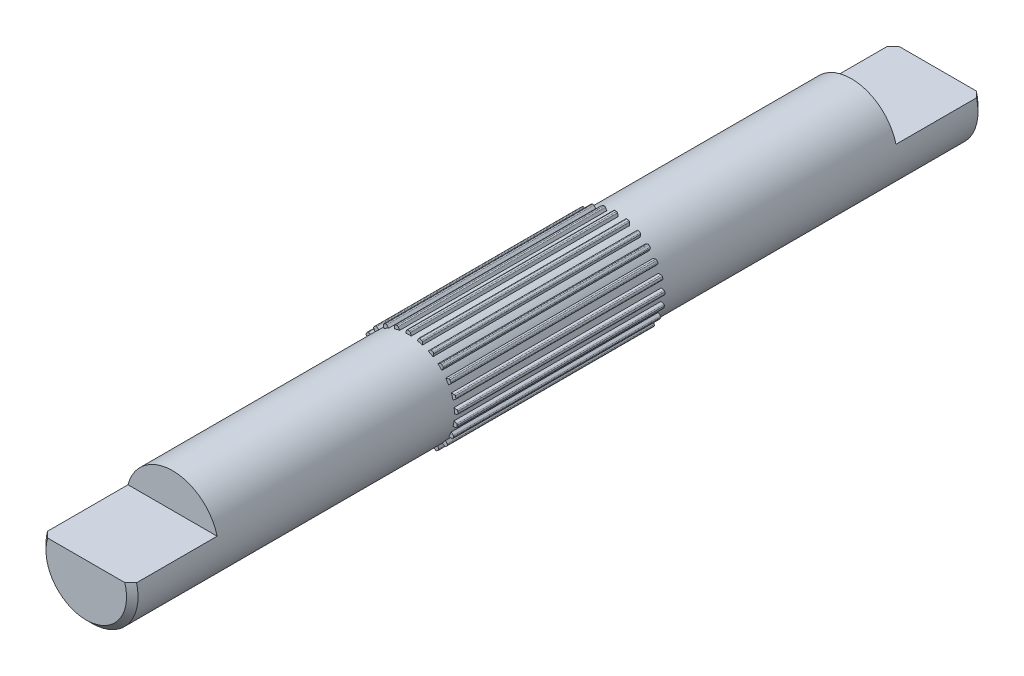
from build123d import *

# Parameters (mm, degrees)
ESQUISSE1_R                  = 4
EXTRUSION1_DEPTH             = 37
EXTRUSION2_DEPTH             = 9
R_P_TITION_CIRCULAIRE2_COUNT = 25
ESQUISSE4_W                  = 8.374546029
ESQUISSE4_H                  = 4.28145912
ENL_V_MAT_EXTRU_2_DEPTH      = 7.5
CHANFREIN1_SIZE              = 0.5


with BuildPart() as part:
    # Esquisse1 → Extrusion1 (new, symmetric)
    with BuildSketch(Plane.XY):
        with Locations(Location((0, 0, 0), (0, 0, 165.522487814))):
            Circle(ESQUISSE1_R)
    extrude(amount=EXTRUSION1_DEPTH, both=True)

    # Esquisse2 → Extrusion2 (add, symmetric)
    with BuildSketch(Plane.XY):
        with BuildLine():
            Line((-0.25, 3.947979407), (-0.170144941, 4.227472113))
            ThreePointArc((-0.170144941, 4.227472113), (-0.134212098, 4.279834865), (-0.073992546, 4.3))
            Line((-0.073992546, 4.3), (0.073992546, 4.3))
            ThreePointArc((0.073992546, 4.3), (0.134212098, 4.279834865), (0.170144941, 4.227472113))
            Line((0.170144941, 4.227472113), (0.25, 3.947979407))
            Line((0.25, 3.947979407), (-0.25, 3.947979407))
        make_face()
    extrusion2 = extrude(amount=EXTRUSION2_DEPTH, both=True)

    # Répétition circulaire2: Extrusion2 ×25 about axis
    r_p_tition_circulaire2_axis = Axis((0, 0, 0), (0, 0, 1))
    for i in range(1, R_P_TITION_CIRCULAIRE2_COUNT):
        add(extrusion2.rotate(r_p_tition_circulaire2_axis, i * 360 / R_P_TITION_CIRCULAIRE2_COUNT))

    # Esquisse4 → Enlèv. mat.-Extru.2 (cut)
    with BuildSketch(Plane.XY.offset(37)):
        with Locations((0.163699973, 3.14072956)):
            Rectangle(ESQUISSE4_W, ESQUISSE4_H)
    enl_v_mat_extru_2 = extrude(amount=-ENL_V_MAT_EXTRU_2_DEPTH, mode=Mode.SUBTRACT)

    # Symétrie1: Enlèv. mat.-Extru.2 across plane
    add(enl_v_mat_extru_2.mirror(Plane.XY), mode=Mode.SUBTRACT)

    # Chanfrein1
    chanfrein1_edges = [part.edges().sort_by_distance(p)[0] for p in [
        (0, -4, 37),
        (0, -4, -37),
    ]]
    chamfer(chanfrein1_edges, length=CHANFREIN1_SIZE)


solid = part.part
